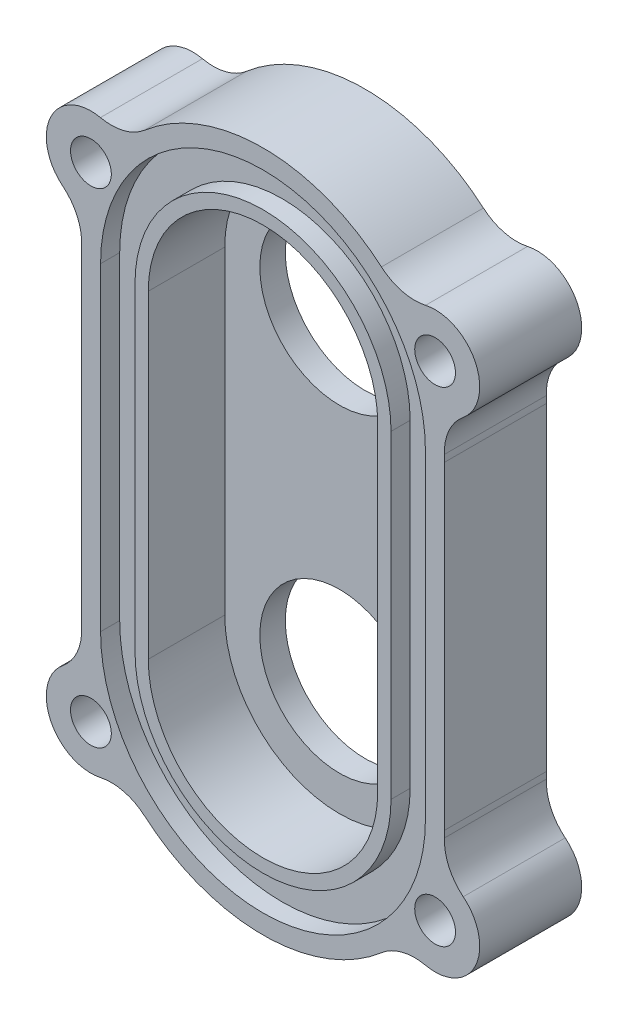
from build123d import *

# Parameters (mm, degrees)
SKETCH_1_R          = 6.25
EXTRUDE_1_DEPTH     = 8
CUT_EXTRUDE_START   = 2
CUT_EXTRUDE_1_DEPTH = 31.682534896
CUT_EXTRUDE_START_2 = 8
CUT_EXTRUDE_4_DEPTH = 1.5
HOLE_WIZARD_M3_2_D  = 3.2


with BuildPart() as part:
    # ｽｹｯﾁ1 → ﾎﾞｽ - 押し出し1 (new body)
    with BuildSketch(Plane.XY):
        with BuildLine():
            Line((-14.242252845, 12.5), (-14.242252845, -12.5))
            ThreePointArc((-14.242252845, -12.5), (-14.23978335, -12.765209825), (-14.232375721, -13.030327679))
            ThreePointArc((-14.232375721, -13.030327679), (-14.58644356, -14.830756402), (-15.707147454, -16.28366053))
            ThreePointArc((-15.707147454, -16.28366053), (-16.653505844, -20.518354666), (-12.752931254, -22.419340329))
            ThreePointArc((-12.752931254, -22.419340329), (-10.918262125, -22.449287076), (-9.290000484, -23.295260864))
            ThreePointArc((-9.290000484, -23.295260864), (0, -26.742252845), (9.290000484, -23.295260864))
            ThreePointArc((9.290000484, -23.295260864), (10.918262125, -22.449287076), (12.752931254, -22.419340329))
            ThreePointArc((12.752931254, -22.419340329), (16.653505844, -20.518354666), (15.707147454, -16.28366053))
            ThreePointArc((15.707147454, -16.28366053), (14.58644356, -14.830756402), (14.232375721, -13.030327679))
            ThreePointArc((14.232375721, -13.030327679), (14.23978335, -12.765209825), (14.242252845, -12.5))
            Line((14.242252845, -12.5), (14.242252845, 12.5))
            ThreePointArc((14.242252845, 12.5), (14.23978335, 12.765209825), (14.232375721, 13.030327679))
            ThreePointArc((14.232375721, 13.030327679), (14.58644356, 14.830756402), (15.707147454, 16.28366053))
            ThreePointArc((15.707147454, 16.28366053), (16.653505844, 20.518354666), (12.752931254, 22.419340329))
            ThreePointArc((12.752931254, 22.419340329), (10.918262125, 22.449287076), (9.290000484, 23.295260864))
            ThreePointArc((9.290000484, 23.295260864), (0, 26.742252845), (-9.290000484, 23.295260864))
            ThreePointArc((-9.290000484, 23.295260864), (-10.918262125, 22.449287076), (-12.752931254, 22.419340329))
            ThreePointArc((-12.752931254, 22.419340329), (-16.653505844, 20.518354666), (-15.707147454, 16.28366053))
            ThreePointArc((-15.707147454, 16.28366053), (-14.58644356, 14.830756402), (-14.232375721, 13.030327679))
            ThreePointArc((-14.232375721, 13.030327679), (-14.23978335, 12.765209825), (-14.242252845, 12.5))
        make_face()
        with Locations((0, 12.5)):
            Circle(SKETCH_1_R, mode=Mode.SUBTRACT)
        with Locations(Location((0, -12.5, 0), (0, 0, 180))):
            Circle(SKETCH_1_R, mode=Mode.SUBTRACT)
    extrude(amount=EXTRUDE_1_DEPTH)

    # ｽｹｯﾁ1<3> → ｶｯﾄ - 押し出し1 (cut, through all)
    with BuildSketch(Plane.XY.offset(CUT_EXTRUDE_START)):
        with BuildLine():
            Line((-9, 12.5), (-9, -12.5))
            ThreePointArc((-9, -12.5), (0, -21.5), (9, -12.5))
            Line((9, -12.5), (9, 12.5))
            ThreePointArc((9, 12.5), (0, 21.5), (-9, 12.5))
        make_face()
    extrude(amount=CUT_EXTRUDE_1_DEPTH, mode=Mode.SUBTRACT)

    # ｽｹｯﾁ1<6> → ｶｯﾄ - 押し出し4 (cut)
    with BuildSketch(Plane.XY.offset(CUT_EXTRUDE_START_2)):
        with BuildLine():
            ThreePointArc((12.742252845, -12.5), (0, -25.242252845), (-12.742252845, -12.5))
            Line((-12.742252845, -12.5), (-12.742252845, 12.5))
            ThreePointArc((-12.742252845, 12.5), (0, 25.242252845), (12.742252845, 12.5))
            Line((12.742252845, 12.5), (12.742252845, -12.5))
        make_face()
        with BuildLine():
            Line((10.042252845, 12.5), (10.042252845, -12.5))
            ThreePointArc((10.042252845, -12.5), (0, -22.542252845), (-10.042252845, -12.5))
            Line((-10.042252845, -12.5), (-10.042252845, 12.5))
            ThreePointArc((-10.042252845, 12.5), (0, 22.542252845), (10.042252845, 12.5))
        make_face(mode=Mode.SUBTRACT)
    extrude(amount=-CUT_EXTRUDE_4_DEPTH, mode=Mode.SUBTRACT)

    # M3 すきま穴2 (through all)
    with Locations(Plane(origin=(-13.5, 19, 0), x_dir=(-1, 0, 0), z_dir=(0, 0, -1))):
        with Locations((0, 0), (0, -38), (-27, -38), (-27, 0)):
            Hole(HOLE_WIZARD_M3_2_D / 2)


solid = part.part
